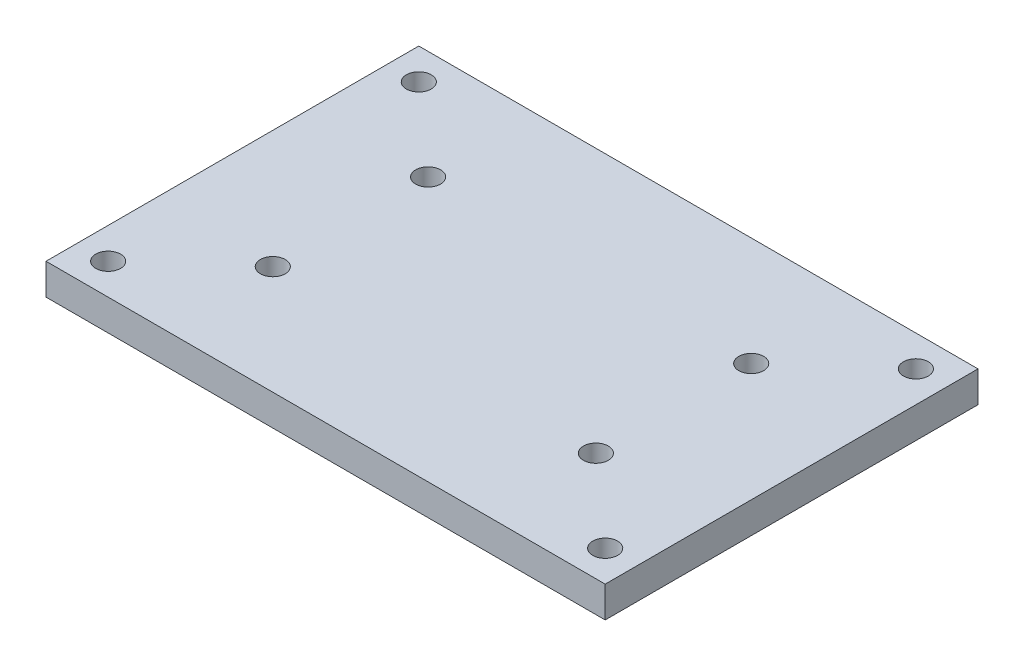
from build123d import *

# Parameters (mm, degrees)
SKETCH_1_W      = 90
SKETCH_1_H      = 60
SKETCH_1_R      = 2
EXTRUDE_1_DEPTH = 5


with BuildPart() as part:
    # 草图1 → 凸台-拉伸1 (new body)
    with BuildSketch(Plane(origin=(0, 0, 0), x_dir=(1, 0, 0), z_dir=(0, 1, 0))):
        Rectangle(SKETCH_1_W, SKETCH_1_H)
        with Locations(Location((-40, 25, 0), (0, 0, 270))):
            Circle(SKETCH_1_R, mode=Mode.SUBTRACT)
        with Locations(Location((40, 25, 0), (0, 0, 270))):
            Circle(SKETCH_1_R, mode=Mode.SUBTRACT)
        with Locations(Location((40, -25, 0), (0, 0, 90))):
            Circle(SKETCH_1_R, mode=Mode.SUBTRACT)
        with Locations(Location((-40, -25, 0), (0, 0, 90))):
            Circle(SKETCH_1_R, mode=Mode.SUBTRACT)
        with Locations(Location((-26, 12.5, 0), (0, 0, 270))):
            Circle(SKETCH_1_R, mode=Mode.SUBTRACT)
        with Locations(Location((26, 12.5, 0), (0, 0, 90))):
            Circle(SKETCH_1_R, mode=Mode.SUBTRACT)
        with Locations(Location((26, -12.5, 0), (0, 0, 270))):
            Circle(SKETCH_1_R, mode=Mode.SUBTRACT)
        with Locations(Location((-26, -12.5, 0), (0, 0, 90))):
            Circle(SKETCH_1_R, mode=Mode.SUBTRACT)
    extrude(amount=EXTRUDE_1_DEPTH)


solid = part.part
